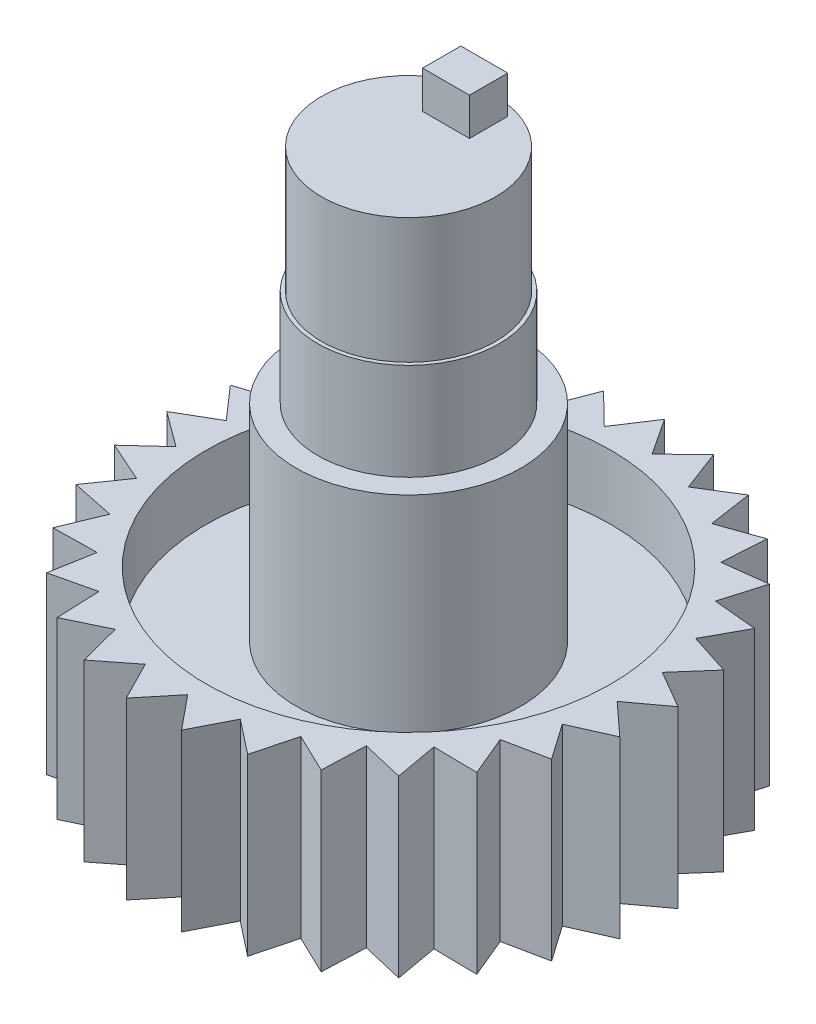
from build123d import *

# Parameters (mm, degrees)
SKETCH2_W           = 1.75
SKETCH2_H           = 1.43
BOSS_EXTRUDE1_DEPTH = 1.4
SKETCH3_R           = 10.06
CUT_EXTRUDE1_DEPTH  = 21.193741605


with BuildPart() as part:
    # Sketch1 → Revolve1 (revolve)
    with BuildSketch(Plane.XY, mode=Mode.PRIVATE) as revolve1_sk:
        Polygon((0, 0), (0, 24.17), (3.25, 24.17), (3.25, 19.49), (3.39, 19.49), (3.39, 15.87), (4.2, 15.87), (4.2, 8.17), (7.56, 8.17), (7.56, 10.57), (9.56, 10.57), (9.56, 4.04), (7.56, 4.04), (7.56, 6.89), (3.365, 6.89), (3.365, 2.46), (2, 2.46), (2, 0), align=None)
    revolve(revolve1_sk.sketch.rotate(Axis((0, 0, 0), (0, 1, 0)), 90), axis=Axis((0, 0, 0), (0, 1, 0)))

    # Sketch2 → Boss-Extrude1 (add)
    with BuildSketch(Plane(origin=(0, 24.17, 0), x_dir=(1, 0, 0), z_dir=(0, 1, 0))):
        with Locations((0, 2.115)):
            Rectangle(SKETCH2_W, SKETCH2_H)
    extrude(amount=BOSS_EXTRUDE1_DEPTH)

    # Sketch3 → Cut-Extrude1 (cut, through all)
    with BuildSketch(Plane(origin=(0, 10.57, 0), x_dir=(1, 0, 0), z_dir=(0, 1, 0))):
        Circle(SKETCH3_R)
        Polygon((0, 9.56), (-0.891981902, 8.201638147), (-2.055117408, 9.336492513), (-2.634237624, 7.818138662), (-4.014139811, 8.676421012), (-4.253319322, 7.069071703), (-5.785465497, 7.610649708), (-5.673520536, 5.989462808), (-7.286269247, 6.189012883), (-6.828434235, 4.629793289), (-8.446375145, 4.477984693), (-7.664057938, 3.053639782), (-9.211537928, 2.557570916), (-8.141318811, 1.334701472), (-9.545979436, 0.517567966), (-8.237900664, -0.446645996), (-9.434061555, -1.546635887), (-7.949287438, -2.207108793), (-8.881017441, -3.538520765), (-7.288974367, -3.864369636), (-7.912706822, -5.364948345), (-6.287836955, -5.340936849), (-6.574406827, -6.940516903), (-4.992687275, -6.567767792), (-4.928694875, -8.191554604), (-3.464085088, -7.487497212), (-3.052522628, -9.059564317), (-1.773506132, -8.057119585), (-1.033617816, -9.50395887), (0, -8.25), (1.033617816, -9.50395887), (1.773506132, -8.057119585), (3.052522628, -9.059564317), (3.464085088, -7.487497212), (4.928694875, -8.191554604), (4.992687275, -6.567767792), (6.574406827, -6.940516903), (6.287836955, -5.340936849), (7.912706822, -5.364948345), (7.288974367, -3.864369636), (8.881017441, -3.538520765), (7.949287438, -2.207108793), (9.434061555, -1.546635887), (8.237900664, -0.446645996), (9.545979436, 0.517567966), (8.141318811, 1.334701472), (9.211537928, 2.557570916), (7.664057938, 3.053639782), (8.446375145, 4.477984693), (6.828434235, 4.629793289), (7.286269247, 6.189012883), (5.673520536, 5.989462808), (5.785465497, 7.610649708), (4.253319322, 7.069071703), (4.014139811, 8.676421012), (2.634237624, 7.818138662), (2.055117408, 9.336492513), (0.891981902, 8.201638147), align=None, mode=Mode.SUBTRACT)
    extrude(amount=-CUT_EXTRUDE1_DEPTH, mode=Mode.SUBTRACT)


solid = part.part
